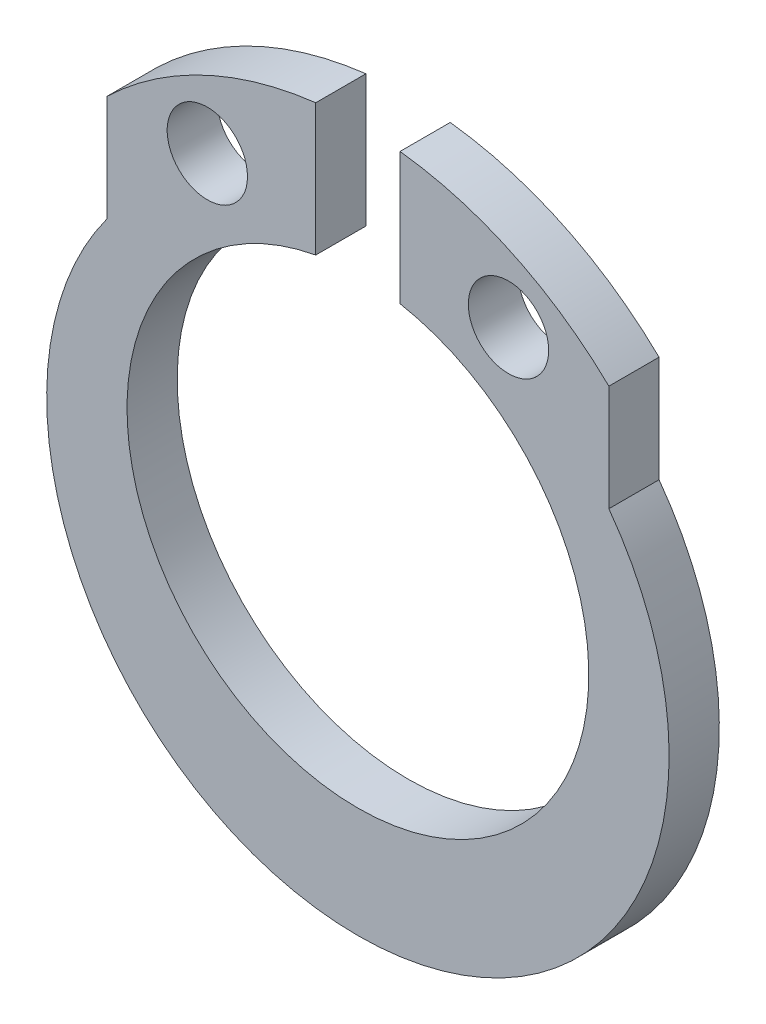
from build123d import *

# Parameters (mm, degrees)
BOSS_EXTRUDE1_DEPTH        = 0.5
SKETCH2_R                  = 2.3
CUT_EXTRUDE1_DEPTH         = 6.006995107
CUT_EXTRUDE2_DEPTH         = 6.006995107
F_0_8_0_8_DIAMETER_HOLE1_D = 0.8


with BuildPart() as part:
    # Sketch1 → Boss-Extrude1 (new body)
    with BuildSketch(Plane.XY):
        with BuildLine():
            Line((-2.5, 2.890366769), (-2.5, 1.833030278))
            ThreePointArc((-2.5, 1.833030278), (0, -3.1), (2.5, 1.833030278))
            Line((2.5, 1.833030278), (2.5, 2.890366769))
            ThreePointArc((2.5, 2.890366769), (0, 3.9), (-2.5, 2.890366769))
        make_face()
    extrude(amount=-BOSS_EXTRUDE1_DEPTH)

    # Sketch2 → Cut-Extrude1 (cut, through all)
    with BuildSketch(Plane.XY):
        with Locations((0, 0.3)):
            Circle(SKETCH2_R)
    extrude(amount=-CUT_EXTRUDE1_DEPTH, mode=Mode.SUBTRACT)

    # Sketch3 → Cut-Extrude2 (cut, through all)
    with BuildSketch(Plane.XY):
        with BuildLine():
            Line((-0.42, 3.87541606), (-0.42, 2.561327044))
            ThreePointArc((-0.42, 2.561327044), (0, 2.6), (0.42, 2.561327044))
            Line((0.42, 2.561327044), (0.42, 3.87541606))
            ThreePointArc((0.42, 3.87541606), (0, 3.9), (-0.42, 3.87541606))
        make_face()
    extrude(amount=-CUT_EXTRUDE2_DEPTH, mode=Mode.SUBTRACT)

    # Ø0.8 (0.8) Diameter Hole1 (through all)
    with Locations(Plane.XY):
        with Locations((-1.5, 2.898076211), (1.5, 2.898076211)):
            Hole(F_0_8_0_8_DIAMETER_HOLE1_D / 2)


solid = part.part
